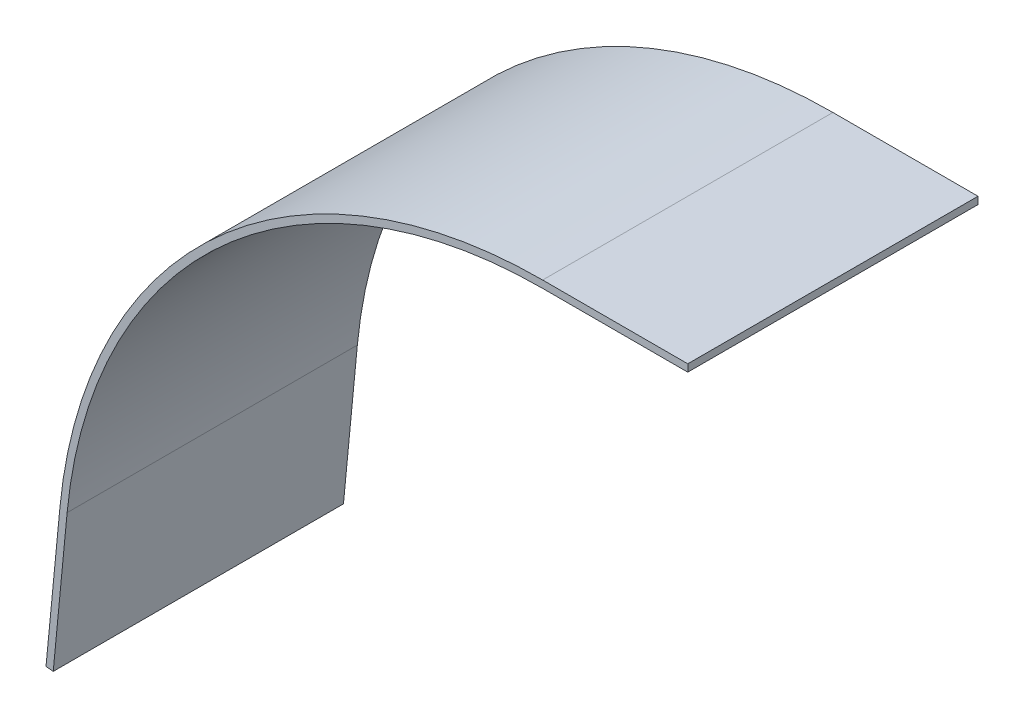
from build123d import *

# Parameters (mm, degrees)
BOSS_EXTRUDE1_DEPTH = 20


with BuildPart() as part:
    # Sketch1 → Boss-Extrude1 (new body)
    with BuildSketch(Plane.XY):
        with BuildLine():
            Line((-34.224539027, -39.924161377), (-33.726836871, -39.972042097))
            Line((-33.726836871, -39.972042097), (-32.769222477, -30.017998965))
            ThreePointArc((-32.769222477, -30.017998965), (-22.135693484, -8.803090448), (0, -0.25))
            Line((0, -0.25), (10, -0.25))
            Line((10, -0.25), (10, 0.25))
            Line((10, 0.25), (0, 0.25))
            ThreePointArc((0, 0.25), (-22.471892562, -8.432995622), (-33.266924633, -29.970118245))
            Line((-33.266924633, -29.970118245), (-34.224539027, -39.924161377))
        make_face()
    extrude(amount=-BOSS_EXTRUDE1_DEPTH)


solid = part.part
